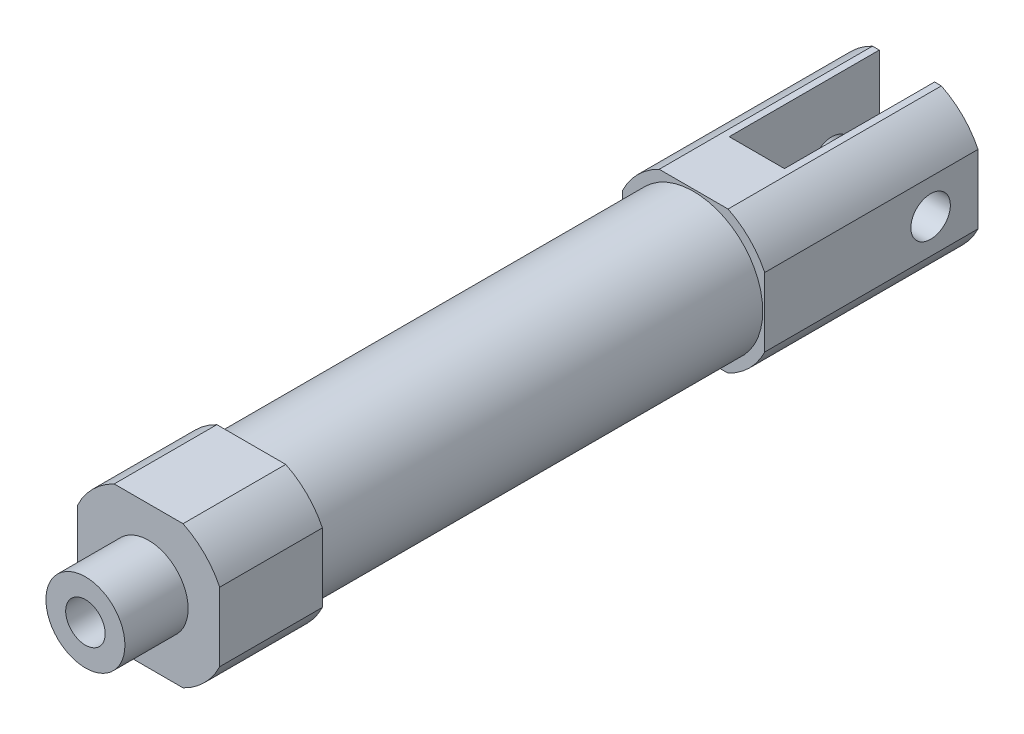
from build123d import *

# Parameters (mm, degrees)
BOSS_EXTRUDE1_DEPTH = 27
SKETCH2_R           = 8.75
BOSS_EXTRUDE2_DEPTH = 56
SKETCH3_R           = 8.75
BOSS_EXTRUDE3_DEPTH = 13
SKETCH4_R           = 5
BOSS_EXTRUDE4_DEPTH = 8
SKETCH6_R           = 2.5
CUT_EXTRUDE1_DEPTH  = 30
CUT_EXTRUDE2_REACH  = 107.929
SKETCH8_R           = 2.5
CUT_EXTRUDE3_DEPTH  = 106.929221653


with BuildPart() as part:
    # Sketch1 → Boss-Extrude1 (new body)
    with BuildSketch(Plane.XY):
        with BuildLine():
            ThreePointArc((-9, -4.358898944), (-7.071067812, -7.071067812), (-4.358898944, -9))
            Line((-4.358898944, -9), (4.358898944, -9))
            ThreePointArc((4.358898944, -9), (7.071067812, -7.071067812), (9, -4.358898944))
            Line((9, -4.358898944), (9, 4.358898944))
            ThreePointArc((9, 4.358898944), (7.071067812, 7.071067812), (4.358898944, 9))
            Line((4.358898944, 9), (-4.358898944, 9))
            ThreePointArc((-4.358898944, 9), (-7.071067812, 7.071067812), (-9, 4.358898944))
            Line((-9, 4.358898944), (-9, -4.358898944))
        make_face()
    extrude(amount=BOSS_EXTRUDE1_DEPTH)

    # Sketch2 → Boss-Extrude2 (add)
    with BuildSketch(Plane.XY.offset(27)):
        Circle(SKETCH2_R)
    extrude(amount=BOSS_EXTRUDE2_DEPTH)

    # Sketch3 → Boss-Extrude3 (add)
    # profile 1 of 2: a face of its own
    with BuildSketch(Plane.XY.offset(83)):
        with BuildLine():
            ThreePointArc((-9, -4.358898944), (-7.071067812, -7.071067812), (-4.358898944, -9))
            Line((-4.358898944, -9), (4.358898944, -9))
            ThreePointArc((4.358898944, -9), (7.071067812, -7.071067812), (9, -4.358898944))
            Line((9, -4.358898944), (9, 4.358898944))
            ThreePointArc((9, 4.358898944), (7.071067812, 7.071067812), (4.358898944, 9))
            Line((4.358898944, 9), (-4.358898944, 9))
            ThreePointArc((-4.358898944, 9), (-7.071067812, 7.071067812), (-9, 4.358898944))
            Line((-9, 4.358898944), (-9, -4.358898944))
        make_face()
        Circle(SKETCH3_R, mode=Mode.SUBTRACT)
    # profile 2 of 2: a face of its own
    with BuildSketch(Plane.XY.offset(83)):
        Circle(SKETCH3_R)
    extrude(amount=BOSS_EXTRUDE3_DEPTH)

    # Sketch4 → Boss-Extrude4 (add)
    with BuildSketch(Plane.XY.offset(96)):
        Circle(SKETCH4_R)
    extrude(amount=BOSS_EXTRUDE4_DEPTH)

    # Sketch6 → Cut-Extrude1 (cut)
    with BuildSketch(Plane.XY.offset(104)):
        Circle(SKETCH6_R)
    extrude(amount=-CUT_EXTRUDE1_DEPTH, mode=Mode.SUBTRACT)

    # Sketch7 → Cut-Extrude2 (cut, up to next)
    with BuildSketch(Plane(origin=(0, 9, 0), x_dir=(1, 0, 0), z_dir=(0, 1, 0)), mode=Mode.PRIVATE) as cut_extrude2_sk1:
        Polygon((0, 0), (-3.5, 0), (-3.5, -19), (3.5, -19), (3.5, 0), align=None)
    cut_extrude2_tool1 = extrude(cut_extrude2_sk1.sketch, amount=-CUT_EXTRUDE2_REACH, mode=Mode.PRIVATE) & part.part
    add(cut_extrude2_tool1.solids().sort_by_distance((0, 9, 9.5))[0], mode=Mode.SUBTRACT)

    # Sketch8 → Cut-Extrude3 (cut, through all)
    with BuildSketch(Plane.ZY.offset(9)):
        with Locations(Location((6, 0, 0), (0, 0, 270))):
            Circle(SKETCH8_R)
    extrude(amount=-CUT_EXTRUDE3_DEPTH, mode=Mode.SUBTRACT)


solid = part.part
